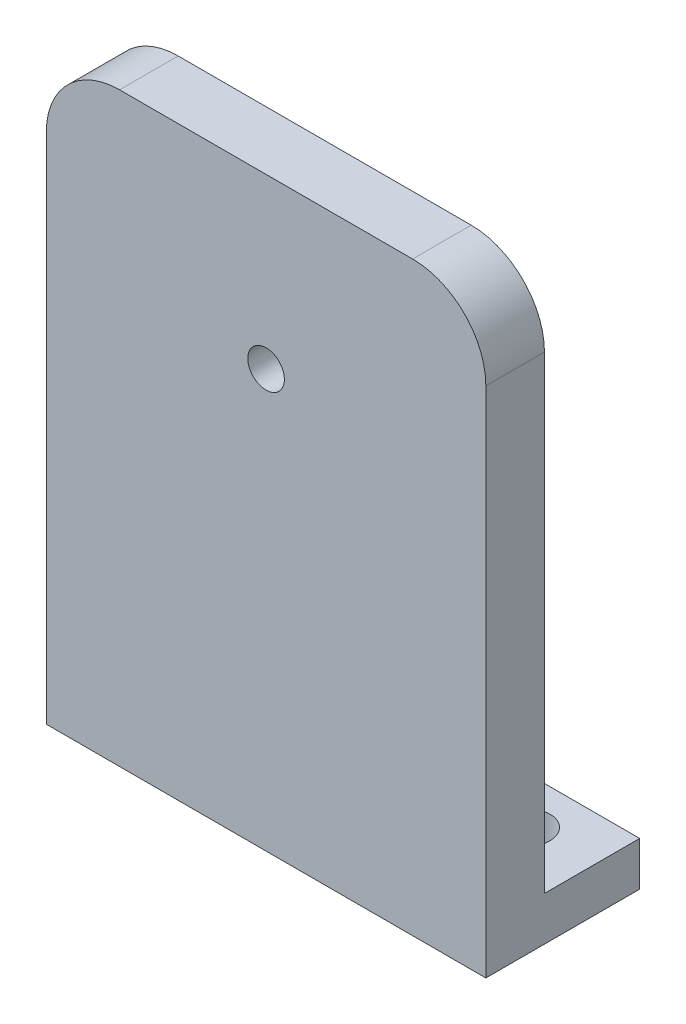
from build123d import *

# Parameters (mm, degrees)
SKETCH1_W           = 30
SKETCH1_H           = 10.5
BOSS_EXTRUDE1_DEPTH = 3
SKETCH2_W           = 30
SKETCH2_H           = 4
BOSS_EXTRUDE2_DEPTH = 37
SKETCH3_R           = 1.575
CUT_EXTRUDE1_DEPTH  = 41.268629229
SKETCH4_R           = 1.575
CUT_EXTRUDE2_DEPTH  = 41.268629229
FILLET1_R           = 5
SKETCH5_R           = 1.25
CUT_EXTRUDE3_DEPTH  = 44.991476447


with BuildPart() as part:
    # Sketch1 → Boss-Extrude1 (new body)
    with BuildSketch(Plane(origin=(0, 0, 0), x_dir=(1, 0, 0), z_dir=(0, 1, 0))):
        Rectangle(SKETCH1_W, SKETCH1_H)
    extrude(amount=BOSS_EXTRUDE1_DEPTH)

    # Sketch2 → Boss-Extrude2 (add)
    with BuildSketch(Plane(origin=(0, 3, 0), x_dir=(1, 0, 0), z_dir=(0, 1, 0))):
        with Locations((0, -3.25)):
            Rectangle(SKETCH2_W, SKETCH2_H)
    extrude(amount=BOSS_EXTRUDE2_DEPTH)

    # Sketch3 → Cut-Extrude1 (cut, through all)
    with BuildSketch(Plane(origin=(0, 3, 0), x_dir=(1, 0, 0), z_dir=(0, 1, 0))):
        with Locations(Location((-10.5, 2.05, 0), (0, 0, 270))):
            Circle(SKETCH3_R)
    extrude(amount=-CUT_EXTRUDE1_DEPTH, mode=Mode.SUBTRACT)

    # Sketch4 → Cut-Extrude2 (cut, through all)
    with BuildSketch(Plane(origin=(0, 3, 0), x_dir=(1, 0, 0), z_dir=(0, 1, 0))):
        with Locations(Location((10.5, 2.05, 0), (0, 0, 270))):
            Circle(SKETCH4_R)
    extrude(amount=-CUT_EXTRUDE2_DEPTH, mode=Mode.SUBTRACT)

    # Fillet1
    fillet1_edges = [part.edges().sort_by_distance(p)[0] for p in [
        (-15, 40, 3.25),
        (15, 40, 3.25),
    ]]
    fillet(fillet1_edges, radius=FILLET1_R)

    # Sketch5 → Cut-Extrude3 (cut, through all)
    with BuildSketch(Plane.XY.offset(5.25)):
        with Locations((0, 28.5)):
            Circle(SKETCH5_R)
    extrude(amount=-CUT_EXTRUDE3_DEPTH, mode=Mode.SUBTRACT)


solid = part.part
